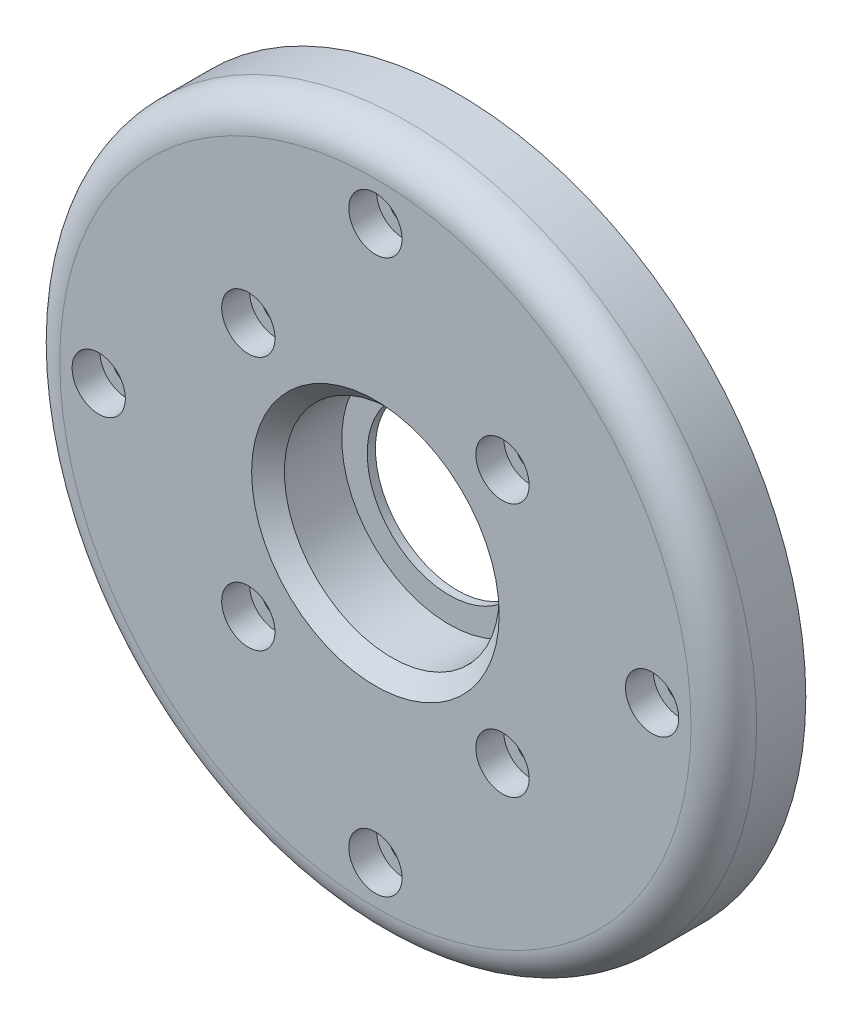
from build123d import *

# Parameters (mm, degrees)
SKIZZE3_R                       = 42.5
AUFSATZ_LINEAR_AUSTRAGEN1_DEPTH = 10
SKIZZE4_R                       = 10
SCHNITT_LINEAR_AUSTRAGEN1_DEPTH = 10
SKIZZE5_R                       = 3.25
SCHNITT_LINEAR_AUSTRAGEN3_DEPTH = 3.4
SKIZZE6_R                       = 1.7
SCHNITT_LINEAR_AUSTRAGEN4_DEPTH = 6.6
KREISMUSTER1_COUNT              = 4
SKIZZE7_R                       = 13.1
SCHNITT_LINEAR_AUSTRAGEN5_DEPTH = 9
VERRUNDUNG1_R                   = 4
FASE1_SIZE                      = 2


with BuildPart() as part:
    # Skizze3 → Aufsatz-Linear austragen1 (new body)
    with BuildSketch(Plane.XY):
        Circle(SKIZZE3_R)
    extrude(amount=AUFSATZ_LINEAR_AUSTRAGEN1_DEPTH)

    # Skizze4 → Schnitt-Linear austragen1 (cut)
    with BuildSketch(Plane.XY.offset(10)):
        Circle(SKIZZE4_R)
    extrude(amount=-SCHNITT_LINEAR_AUSTRAGEN1_DEPTH, mode=Mode.SUBTRACT)

    # Skizze5 → Schnitt-Linear austragen3 (cut)
    with BuildSketch(Plane.XY.offset(10)):
        with Locations((-15.5, 15.5)):
            Circle(SKIZZE5_R)
        with Locations((-33.75, 0)):
            Circle(SKIZZE5_R)
    schnitt_linear_austragen3 = extrude(amount=-SCHNITT_LINEAR_AUSTRAGEN3_DEPTH, mode=Mode.SUBTRACT)

    # Skizze6 → Schnitt-Linear austragen4 (cut)
    with BuildSketch(Plane.XY.offset(6.6)):
        with Locations((-15.5, 15.5)):
            Circle(SKIZZE6_R)
        with Locations((-33.75, 0)):
            Circle(SKIZZE6_R)
    schnitt_linear_austragen4 = extrude(amount=-SCHNITT_LINEAR_AUSTRAGEN4_DEPTH, mode=Mode.SUBTRACT)

    # Kreismuster1: Schnitt-Linear austragen3, Schnitt-Linear austragen4 ×4 about axis
    kreismuster1_axis = Axis((0, 0, 0), (0, 0, 1))
    add([schnitt_linear_austragen3.rotate(kreismuster1_axis, i * 360 / KREISMUSTER1_COUNT) for i in range(1, KREISMUSTER1_COUNT)], mode=Mode.SUBTRACT)
    add([schnitt_linear_austragen4.rotate(kreismuster1_axis, i * 360 / KREISMUSTER1_COUNT) for i in range(1, KREISMUSTER1_COUNT)], mode=Mode.SUBTRACT)

    # Skizze7 → Schnitt-Linear austragen5 (cut)
    with BuildSketch(Plane.XY.offset(10)):
        Circle(SKIZZE7_R)
    extrude(amount=-SCHNITT_LINEAR_AUSTRAGEN5_DEPTH, mode=Mode.SUBTRACT)

    # Verrundung1
    verrundung1_edges = [part.edges().sort_by_distance(p)[0] for p in [
        (-42.5, 0, 10),
    ]]
    fillet(verrundung1_edges, radius=VERRUNDUNG1_R)

    # Fase1
    fase1_edges = [part.edges().sort_by_distance(p)[0] for p in [
        (-13.1, 0, 10),
    ]]
    chamfer(fase1_edges, length=FASE1_SIZE)


solid = part.part
